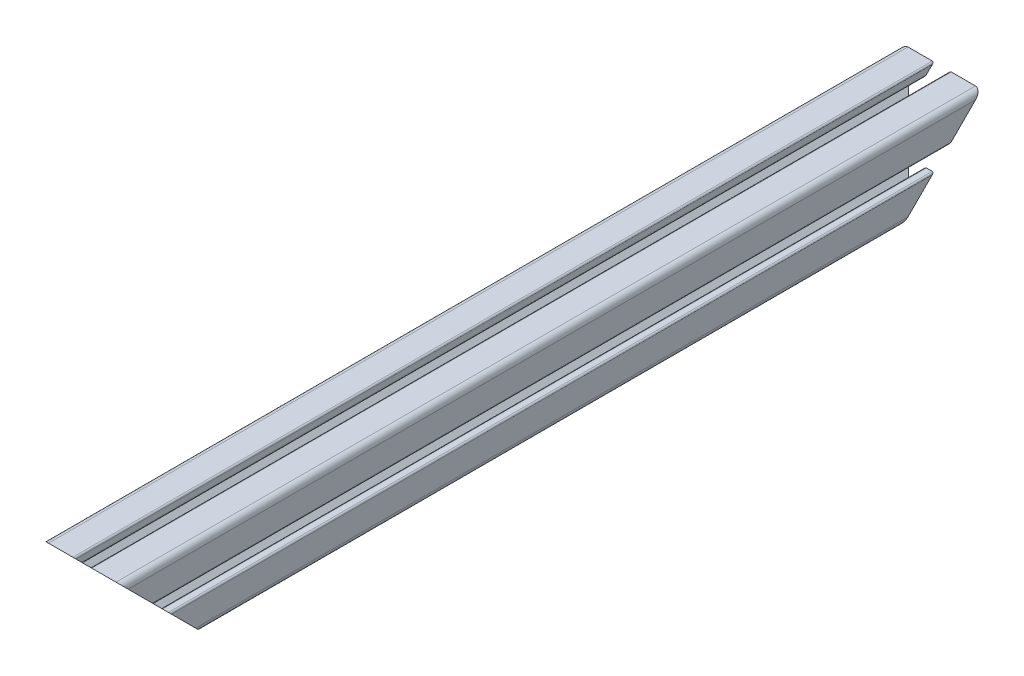
from build123d import *

# Parameters (mm, degrees)
SKETCH1_R          = 3.4036
EXTRUDE1_DEPTH     = 215.9
CUT_EXTRUDE1_DEPTH = 436.22027791
CUT_EXTRUDE2_DEPTH = 3.048
CUT_EXTRUDE5_REACH = 437.22
CUT_EXTRUDE6_DEPTH = 3.048


with BuildPart() as part:
    # Sketch1 → Extrude1 (new, symmetric)
    with BuildSketch(Plane.XY):
        with BuildLine():
            Line((-20, 16.952), (-20, 4.7625))
            ThreePointArc((-20, 4.7625), (-19.776815367, 4.223684633), (-19.238, 4.0005))
            Line((-19.238, 4.0005), (-16.2662, 4.0005))
            ThreePointArc((-16.2662, 4.0005), (-15.727384633, 4.223684633), (-15.5042, 4.7625))
            Line((-15.5042, 4.7625), (-15.5042, 10.485558599))
            ThreePointArc((-15.5042, 10.485558599), (-15.033804775, 11.189554802), (-14.203384633, 11.024373966))
            Line((-14.203384633, 11.024373966), (-8.635059555, 5.456048889))
            ThreePointArc((-8.635059555, 5.456048889), (-7.985348265, 4.483687227), (-7.7572, 3.336708444))
            Line((-7.7572, 3.336708444), (-7.7572, -3.336708444))
            ThreePointArc((-7.7572, -3.336708444), (-7.985348265, -4.483687227), (-8.635059555, -5.456048889))
            Line((-8.635059555, -5.456048889), (-14.203384633, -11.024373966))
            ThreePointArc((-14.203384633, -11.024373966), (-15.033804775, -11.189554802), (-15.5042, -10.485558599))
            Line((-15.5042, -10.485558599), (-15.5042, -4.7625))
            ThreePointArc((-15.5042, -4.7625), (-15.727384633, -4.223684633), (-16.2662, -4.0005))
            Line((-16.2662, -4.0005), (-19.238, -4.0005))
            ThreePointArc((-19.238, -4.0005), (-19.776815367, -4.223684633), (-20, -4.7625))
            Line((-20, -4.7625), (-20, -16.952))
            ThreePointArc((-20, -16.952), (-19.107261469, -19.107261469), (-16.952, -20))
            Line((-16.952, -20), (-4.7625, -20))
            ThreePointArc((-4.7625, -20), (-4.223684633, -19.776815367), (-4.0005, -19.238))
            Line((-4.0005, -19.238), (-4.0005, -16.2662))
            ThreePointArc((-4.0005, -16.2662), (-4.223684633, -15.727384633), (-4.7625, -15.5042))
            Line((-4.7625, -15.5042), (-10.485558599, -15.5042))
            ThreePointArc((-10.485558599, -15.5042), (-11.189554802, -15.033804775), (-11.024373966, -14.203384633))
            Line((-11.024373966, -14.203384633), (-5.456048889, -8.635059555))
            ThreePointArc((-5.456048889, -8.635059555), (-4.483687227, -7.985348265), (-3.336708444, -7.7572))
            Line((-3.336708444, -7.7572), (3.336708444, -7.7572))
            ThreePointArc((3.336708444, -7.7572), (4.483687227, -7.985348265), (5.456048889, -8.635059555))
            Line((5.456048889, -8.635059555), (11.024373966, -14.203384633))
            ThreePointArc((11.024373966, -14.203384633), (11.189554802, -15.033804775), (10.485558599, -15.5042))
            Line((10.485558599, -15.5042), (4.7625, -15.5042))
            ThreePointArc((4.7625, -15.5042), (4.223684633, -15.727384633), (4.0005, -16.2662))
            Line((4.0005, -16.2662), (4.0005, -19.238))
            ThreePointArc((4.0005, -19.238), (4.223684633, -19.776815367), (4.7625, -20))
            Line((4.7625, -20), (16.952, -20))
            ThreePointArc((16.952, -20), (19.107261469, -19.107261469), (20, -16.952))
            Line((20, -16.952), (20, -4.7625))
            ThreePointArc((20, -4.7625), (19.776815367, -4.223684633), (19.238, -4.0005))
            Line((19.238, -4.0005), (16.2662, -4.0005))
            ThreePointArc((16.2662, -4.0005), (15.727384633, -4.223684633), (15.5042, -4.7625))
            Line((15.5042, -4.7625), (15.5042, -10.485558599))
            ThreePointArc((15.5042, -10.485558599), (15.033804775, -11.189554802), (14.203384633, -11.024373966))
            Line((14.203384633, -11.024373966), (8.635059555, -5.456048889))
            ThreePointArc((8.635059555, -5.456048889), (7.985348265, -4.483687227), (7.7572, -3.336708444))
            Line((7.7572, -3.336708444), (7.7572, 3.336708444))
            ThreePointArc((7.7572, 3.336708444), (7.985348265, 4.483687227), (8.635059555, 5.456048889))
            Line((8.635059555, 5.456048889), (14.203384633, 11.024373966))
            ThreePointArc((14.203384633, 11.024373966), (15.033804775, 11.189554802), (15.5042, 10.485558599))
            Line((15.5042, 10.485558599), (15.5042, 4.7625))
            ThreePointArc((15.5042, 4.7625), (15.727384633, 4.223684633), (16.2662, 4.0005))
            Line((16.2662, 4.0005), (19.238, 4.0005))
            ThreePointArc((19.238, 4.0005), (19.776815367, 4.223684633), (20, 4.7625))
            Line((20, 4.7625), (20, 16.952))
            ThreePointArc((20, 16.952), (19.107261469, 19.107261469), (16.952, 20))
            Line((16.952, 20), (4.7625, 20))
            ThreePointArc((4.7625, 20), (4.223684633, 19.776815367), (4.0005, 19.238))
            Line((4.0005, 19.238), (4.0005, 16.2662))
            ThreePointArc((4.0005, 16.2662), (4.223684633, 15.727384633), (4.7625, 15.5042))
            Line((4.7625, 15.5042), (10.485558599, 15.5042))
            ThreePointArc((10.485558599, 15.5042), (11.189554802, 15.033804775), (11.024373966, 14.203384633))
            Line((11.024373966, 14.203384633), (5.456048889, 8.635059555))
            ThreePointArc((5.456048889, 8.635059555), (4.483687227, 7.985348265), (3.336708444, 7.7572))
            Line((3.336708444, 7.7572), (-3.336708444, 7.7572))
            ThreePointArc((-3.336708444, 7.7572), (-4.483687227, 7.985348265), (-5.456048889, 8.635059555))
            Line((-5.456048889, 8.635059555), (-11.024373966, 14.203384633))
            ThreePointArc((-11.024373966, 14.203384633), (-11.189554802, 15.033804775), (-10.485558599, 15.5042))
            Line((-10.485558599, 15.5042), (-4.7625, 15.5042))
            ThreePointArc((-4.7625, 15.5042), (-4.223684633, 15.727384633), (-4.0005, 16.2662))
            Line((-4.0005, 16.2662), (-4.0005, 19.238))
            ThreePointArc((-4.0005, 19.238), (-4.223684633, 19.776815367), (-4.7625, 20))
            Line((-4.7625, 20), (-16.952, 20))
            ThreePointArc((-16.952, 20), (-19.107261469, 19.107261469), (-20, 16.952))
        make_face()
        Circle(SKETCH1_R, mode=Mode.SUBTRACT)
    extrude(amount=EXTRUDE1_DEPTH, both=True)

    # Sketch3 → Cut-Extrude1 (cut, through all)
    with BuildSketch(Plane(origin=(-16.952, 20, 215.9), x_dir=(0, 0, 1), z_dir=(-1, 0, 0))):
        Polygon((0, 0), (-40, -40), (0, -40), align=None)
    extrude(amount=-CUT_EXTRUDE1_DEPTH, mode=Mode.SUBTRACT)

    # Sketch4 → Cut-Extrude2 (cut)
    with BuildSketch(Plane(origin=(-16.952, 0, 0), x_dir=(0, 0, -1), z_dir=(1, 0, 0))):
        Polygon((-215.9, 20), (-215.9, -20), (-175.9, -20), align=None)
    extrude(amount=-CUT_EXTRUDE2_DEPTH, mode=Mode.SUBTRACT)

    # Cut-Extrude5: up to this face of the body (flat: up to its plane)
    cut_extrude5_end = Plane(part.part.faces().sort_by_distance((20, 10.886545588, -4.556727206))[0])
    # Sketch9 → Cut-Extrude5 (cut, up to the picked face)
    with BuildSketch(Plane(origin=(-16.952, 20, 215.9), x_dir=(0, 0, 1), z_dir=(-1, 0, 0)), mode=Mode.PRIVATE) as cut_extrude5_sk1:
        Polygon((-431.8, 0), (-391.8, -40), (-431.8, -40), align=None)
    cut_extrude5_tool1 = split(extrude(cut_extrude5_sk1.sketch, amount=-CUT_EXTRUDE5_REACH, mode=Mode.PRIVATE), bisect_by=cut_extrude5_end, keep=Keep.BOTH, mode=Mode.PRIVATE)
    add(cut_extrude5_tool1.solids().sort_by(Axis((-16.952, -6.666667, -202.566667), (1, 0, 0)))[0], mode=Mode.SUBTRACT)

    # Sketch11 → Cut-Extrude6 (cut)
    with BuildSketch(Plane(origin=(-16.952, 0, 0), x_dir=(0, 0, -1), z_dir=(1, 0, 0))):
        Polygon((175.9, -20), (215.9, 20), (215.9, -20), align=None)
    extrude(amount=-CUT_EXTRUDE6_DEPTH, mode=Mode.SUBTRACT)


solid = part.part
